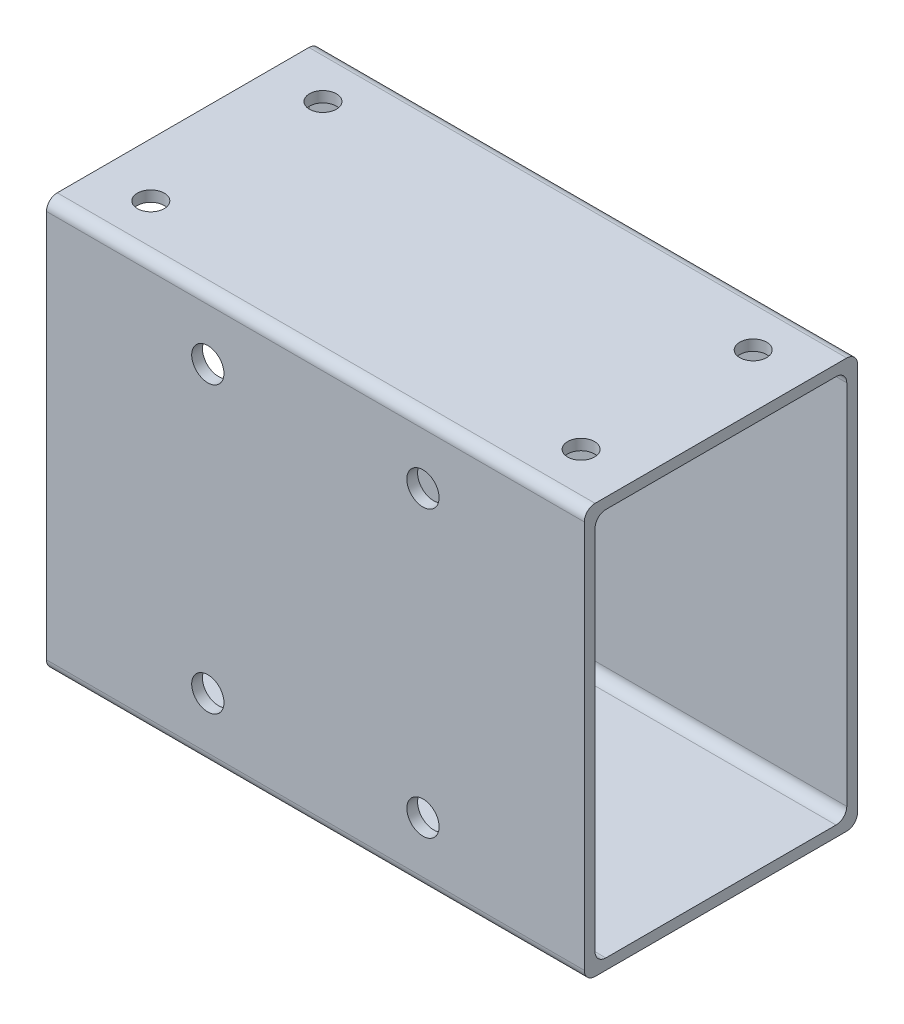
from build123d import *

# Parameters (mm, degrees)
SKETCH1_W             = 50.8
SKETCH1_H             = 76.2
BOSS_EXTRUDE1_DEPTH   = 100
SKETCH2_W             = 46.8
SKETCH2_H             = 72.2
CUT_EXTRUDE1_DEPTH    = 110.985317202
FILLET2_R             = 2
CORTAR_EXTRUIR2_DEPTH = 10
CROQUIS8_R            = 2.5
CORTAR_EXTRUIR8_DEPTH = 10


with BuildPart() as part:
    # Sketch1 → Boss-Extrude1 (new body)
    with BuildSketch(Plane(origin=(0, 0, 0), x_dir=(0, 0, -1), z_dir=(1, 0, 0))):
        Rectangle(SKETCH1_W, SKETCH1_H)
    extrude(amount=-BOSS_EXTRUDE1_DEPTH)

    # Sketch2 → Cut-Extrude1 (cut, through all)
    with BuildSketch(Plane(origin=(0, 0, 0), x_dir=(0, 0, -1), z_dir=(1, 0, 0))):
        Rectangle(SKETCH2_W, SKETCH2_H)
    extrude(amount=-CUT_EXTRUDE1_DEPTH, mode=Mode.SUBTRACT)

    # Fillet2
    fillet2_edges = [part.edges().sort_by_distance(p)[0] for p in [
        (-50, -36.1, 23.4),
        (-50, 36.1, 23.4),
        (-50, 36.1, -23.4),
        (-50, -36.1, -23.4),
        (-50, 38.1, 25.4),
        (-50, 38.1, -25.4),
        (-50, -38.1, -25.4),
        (-50, -38.1, 25.4),
    ]]
    fillet(fillet2_edges, radius=FILLET2_R)

    # Croquis2 → Cortar-Extruir2 (cut)
    with BuildSketch(Plane.XY.offset(25.4)):
        with BuildLine():
            ThreePointArc((-27, 26.5), (-30, 29.5), (-33, 26.5))
            Line((-33, 26.5), (-30, 26.5))
            Line((-30, 26.5), (-30, 23.5))
            ThreePointArc((-30, 23.5), (-27.878679656, 24.378679656), (-27, 26.5))
        make_face()
        with BuildLine():
            Line((-30, 26.5), (-33, 26.5))
            ThreePointArc((-33, 26.5), (-32.121320344, 24.378679656), (-30, 23.5))
            Line((-30, 23.5), (-30, 26.5))
        make_face()
        with BuildLine():
            ThreePointArc((-70, 23.5), (-67.878679656, 24.378679656), (-67, 26.5))
            Line((-67, 26.5), (-70, 26.5))
            Line((-70, 26.5), (-70, 23.5))
        make_face()
        with BuildLine():
            Line((-70, 26.5), (-67, 26.5))
            ThreePointArc((-67, 26.5), (-72.121320344, 28.621320344), (-70, 23.5))
            Line((-70, 23.5), (-70, 26.5))
        make_face()
        with BuildLine():
            ThreePointArc((-67, -26.5), (-67.878679656, -24.378679656), (-70, -23.5))
            Line((-70, -23.5), (-70, -26.5))
            Line((-70, -26.5), (-67, -26.5))
        make_face()
        with BuildLine():
            Line((-70, -26.5), (-70, -23.5))
            ThreePointArc((-70, -23.5), (-72.121320344, -28.621320344), (-67, -26.5))
            Line((-67, -26.5), (-70, -26.5))
        make_face()
        with BuildLine():
            ThreePointArc((-27, -26.5), (-27.878679656, -24.378679656), (-30, -23.5))
            Line((-30, -23.5), (-30, -26.5))
            Line((-30, -26.5), (-33, -26.5))
            ThreePointArc((-33, -26.5), (-30, -29.5), (-27, -26.5))
        make_face()
        with BuildLine():
            Line((-30, -26.5), (-30, -23.5))
            ThreePointArc((-30, -23.5), (-32.121320344, -24.378679656), (-33, -26.5))
            Line((-33, -26.5), (-30, -26.5))
        make_face()
    extrude(amount=-CORTAR_EXTRUIR2_DEPTH, mode=Mode.SUBTRACT)

    # Croquis8 → Cortar-Extruir8 (cut)
    with BuildSketch(Plane(origin=(0, 38.1, 0), x_dir=(1, 0, 0), z_dir=(0, 1, 0))):
        with Locations(Location((-90, 16, 0), (0, 0, 270))):
            Circle(CROQUIS8_R)
        with Locations(Location((-10, 16, 0), (0, 0, 270))):
            Circle(CROQUIS8_R)
        with Locations(Location((-90, -16, 0), (0, 0, 270))):
            Circle(CROQUIS8_R)
        with Locations(Location((-10, -16, 0), (0, 0, 270))):
            Circle(CROQUIS8_R)
    extrude(amount=-CORTAR_EXTRUIR8_DEPTH, mode=Mode.SUBTRACT)


solid = part.part
